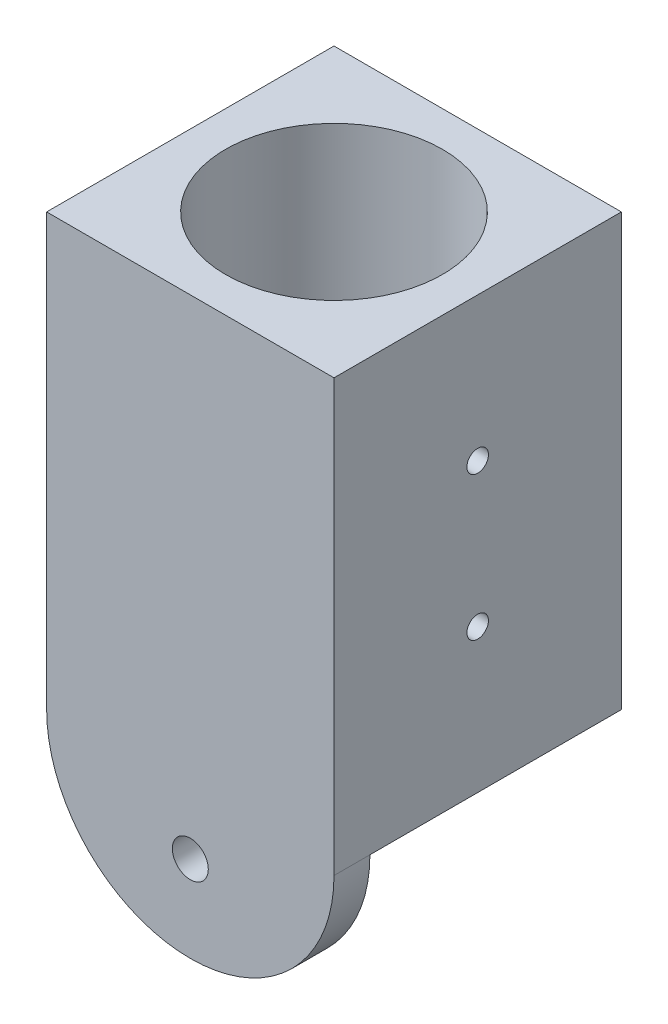
from build123d import *

# Parameters (mm, degrees)
SKETCH_1_W             = 40
SKETCH_1_H             = 40
EXTRUDE_1_DEPTH        = 60
SKETCH_2_R             = 15.1
CUT_EXTRUDE_1_DEPTH    = 50
SKETCH_3_R             = 2.5
EXTRUDE_2_DEPTH        = 5
SKETCH_4_R             = 1.5
CUT_EXTRUDE_2_DEPTH    = 75.833147735
PATTERN_LINEAR_1_COUNT = 2
PATTERN_LINEAR_1_PITCH = 20


with BuildPart() as part:
    # 草圖1 → 填料-伸長1 (new body)
    with BuildSketch(Plane(origin=(0, 0, 0), x_dir=(1, 0, 0), z_dir=(0, 1, 0))):
        Rectangle(SKETCH_1_W, SKETCH_1_H)
    extrude(amount=EXTRUDE_1_DEPTH)

    # 草圖2 → 除料-伸長1 (cut)
    with BuildSketch(Plane(origin=(0, 60, 0), x_dir=(1, 0, 0), z_dir=(0, 1, 0))):
        with Locations(Location((0, 0, 0), (0, 0, 270))):
            Circle(SKETCH_2_R)
    extrude(amount=-CUT_EXTRUDE_1_DEPTH, mode=Mode.SUBTRACT)

    # 草圖3 → 填料-伸長2 (add)
    with BuildSketch(Plane.XY.offset(20)):
        with BuildLine():
            Line((-20, 0), (20, 0))
            ThreePointArc((20, 0), (0, -20), (-20, 0))
        make_face()
        with Locations((0, -8)):
            Circle(SKETCH_3_R, mode=Mode.SUBTRACT)
    extrude(amount=-EXTRUDE_2_DEPTH)

    # 草圖4 → 除料-伸長2 (cut, through all)
    with BuildSketch(Plane(origin=(20, 0, 0), x_dir=(0, 0, -1), z_dir=(1, 0, 0))):
        with Locations((0, 20)):
            Circle(SKETCH_4_R)
    cut_extrude_2 = extrude(amount=-CUT_EXTRUDE_2_DEPTH, mode=Mode.SUBTRACT)

    # 直線複製排列1: 除料-伸長2 ×2
    with Locations(*[(0, i * PATTERN_LINEAR_1_PITCH, 0) for i in range(1, PATTERN_LINEAR_1_COUNT)]):
        add(cut_extrude_2, mode=Mode.SUBTRACT)


solid = part.part
